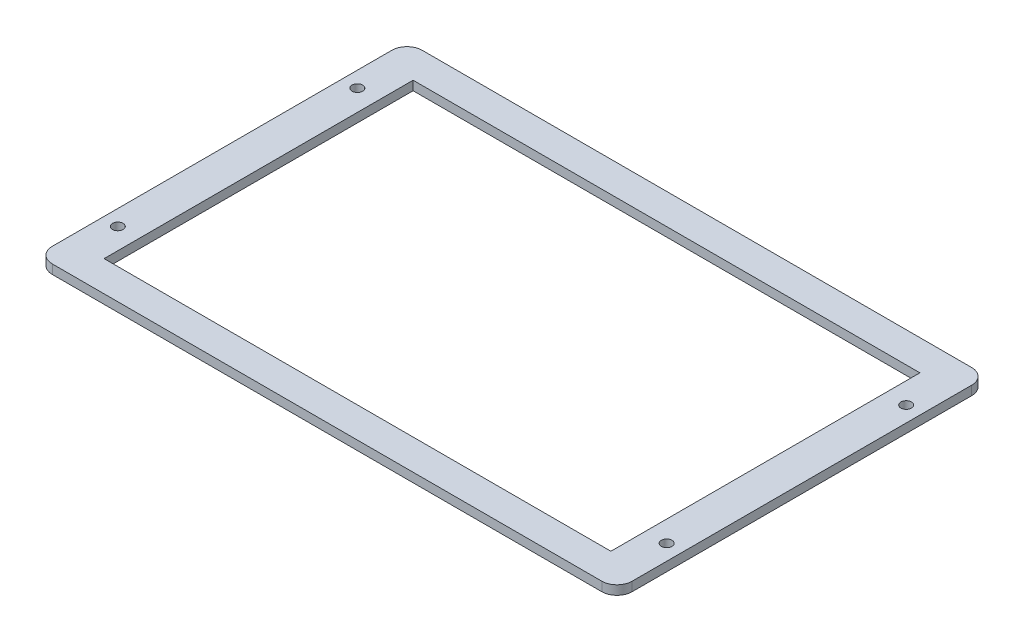
from build123d import *

# Parameters (mm, degrees)
SKETCH1_W          = 190.3
SKETCH1_H          = 121.4
SKETCH1_W_2        = 166.3
SKETCH1_H_2        = 101.4
EXTRUDE1_DEPTH     = 3
FILLET1_R          = 5
SKETCH2_R          = 1.75
CUT_EXTRUDE1_DEPTH = 3


with BuildPart() as part:
    # Sketch1 → Extrude1 (new body)
    with BuildSketch(Plane(origin=(0, 0, 0), x_dir=(1, 0, 0), z_dir=(0, 1, 0))):
        Rectangle(SKETCH1_W, SKETCH1_H)
        Rectangle(SKETCH1_W_2, SKETCH1_H_2, mode=Mode.SUBTRACT)
    extrude(amount=EXTRUDE1_DEPTH)

    # Fillet1
    fillet1_edges = [part.edges().sort_by_distance(p)[0] for p in [
        (-95.15, 1.5, -60.7),
        (95.15, 1.5, -60.7),
        (95.15, 1.5, 60.7),
        (-95.15, 1.5, 60.7),
    ]]
    fillet(fillet1_edges, radius=FILLET1_R)

    # Sketch2 → Cut-Extrude1 (cut)
    with BuildSketch(Plane(origin=(-128.478742323, 3, 300.3), x_dir=(1, 0, 0), z_dir=(0, 1, 0))):
        with Locations(Location((38.428742323, 339.6, 0), (0, 0, 270))):
            Circle(SKETCH2_R)
        with Locations(Location((218.528742323, 339.6, 0), (0, 0, 270))):
            Circle(SKETCH2_R)
        with Locations(Location((218.528742323, 261, 0), (0, 0, 270))):
            Circle(SKETCH2_R)
        with Locations(Location((38.428742323, 261, 0), (0, 0, 270))):
            Circle(SKETCH2_R)
    extrude(amount=-CUT_EXTRUDE1_DEPTH, mode=Mode.SUBTRACT)


solid = part.part
